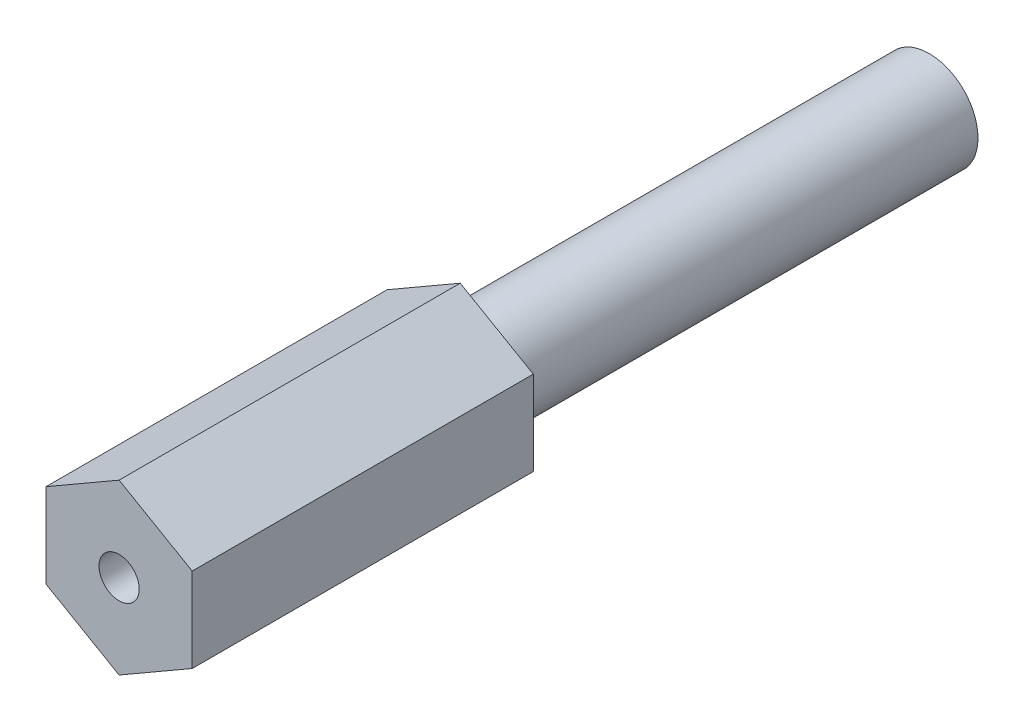
from build123d import *

# Parameters (mm, degrees)
BASE_EXTRUSION_DEPTH = 28
ESQUISSE2_R          = 4
BOSS_EXTRU_1_DEPTH   = 38.5
PER_AGE1_D           = 3.3
PER_AGE1_DEPTH       = 25
PER_AGE1_TIP         = 0.991420021
PER_AGE2_D           = 3.3
PER_AGE2_DEPTH       = 25
PER_AGE2_TIP         = 0.991420021


with BuildPart() as part:
    # Esquisse1 → Base-Extrusion (new body)
    with BuildSketch(Plane.XY):
        Polygon((0, 6.92820323), (-6, 3.464101615), (-6, -3.464101615), (0, -6.92820323), (6, -3.464101615), (6, 3.464101615), align=None)
    extrude(amount=BASE_EXTRUSION_DEPTH)

    # Esquisse2 → Boss.-Extru.1 (add)
    with BuildSketch(Plane(origin=(0, 0, 0), x_dir=(-1, 0, 0), z_dir=(0, 0, -1))):
        with Locations(Location((0, 0, 0), (0, 0, 180))):
            Circle(ESQUISSE2_R)
    extrude(amount=BOSS_EXTRU_1_DEPTH)

    # Perçage1
    with Locations(Plane.XY.offset(28)):
        with Locations((0, 0)):
            Hole(PER_AGE1_D / 2, depth=PER_AGE1_DEPTH)
            with Locations((0, 0, -(PER_AGE1_DEPTH + PER_AGE1_TIP / 2))):  # 118° drill point
                Cone(0, PER_AGE1_D / 2, PER_AGE1_TIP, mode=Mode.SUBTRACT)

    # Perçage2
    with Locations(Plane(origin=(0, 0, -38.5), x_dir=(-1, 0, 0), z_dir=(0, 0, -1))):
        with Locations((0, 0)):
            Hole(PER_AGE2_D / 2, depth=PER_AGE2_DEPTH)
            with Locations((0, 0, -(PER_AGE2_DEPTH + PER_AGE2_TIP / 2))):  # 118° drill point
                Cone(0, PER_AGE2_D / 2, PER_AGE2_TIP, mode=Mode.SUBTRACT)


solid = part.part
